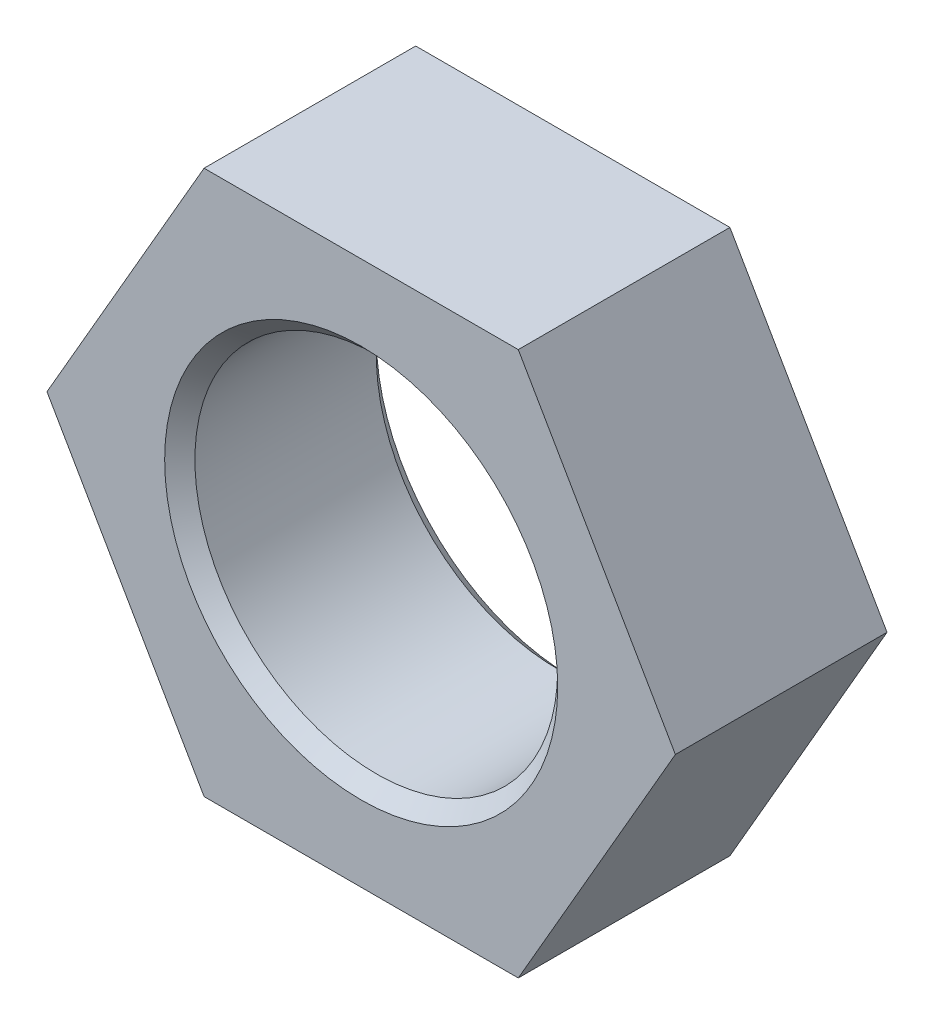
from build123d import *

# Parameters (mm, degrees)
IZIM1_R                     = 3
Y_KSEKLIK_EKSTR_ZYON1_DEPTH = 3.5
PAH1_SIZE                   = 0.25


with BuildPart() as part:
    # Çizim1 → Yükseklik-Ekstrüzyon1 (new body)
    with BuildSketch(Plane.XY):
        Polygon((5.196152423, 0), (2.598076211, 4.5), (-2.598076211, 4.5), (-5.196152423, 0), (-2.598076211, -4.5), (2.598076211, -4.5), align=None)
        Circle(IZIM1_R, mode=Mode.SUBTRACT)
    extrude(amount=Y_KSEKLIK_EKSTR_ZYON1_DEPTH)

    # Pah1
    pah1_edges = [part.edges().sort_by_distance(p)[0] for p in [
        (-3, 0, 0),
        (-3, 0, 3.5),
    ]]
    chamfer(pah1_edges, length=PAH1_SIZE)


solid = part.part
